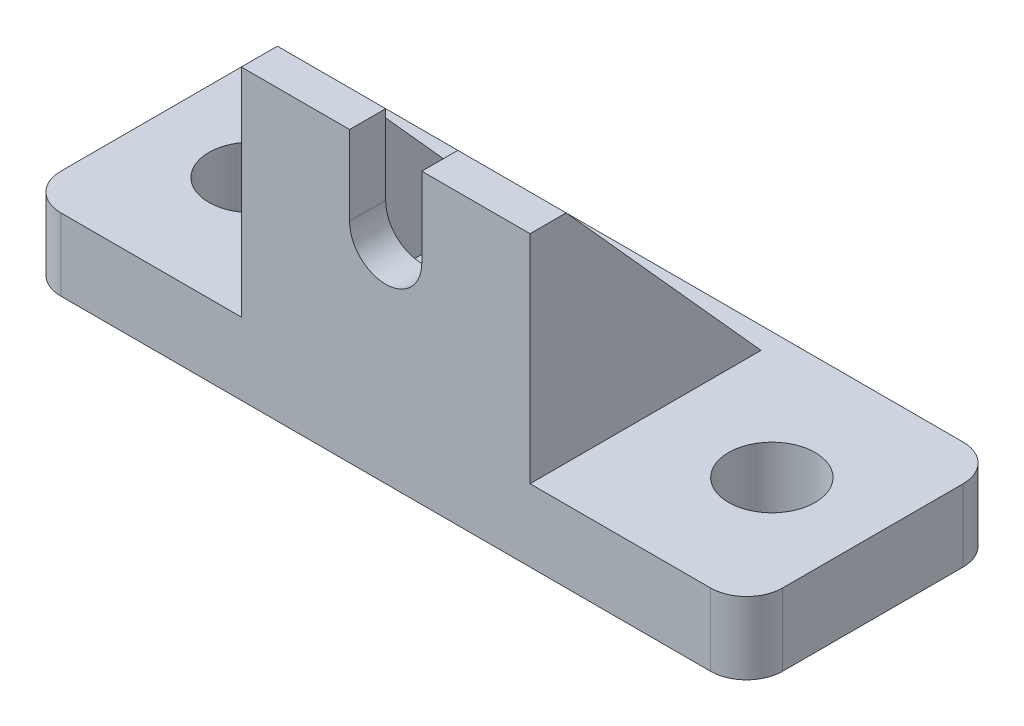
from build123d import *

# Parameters (mm, degrees)
IZIM1_R                     = 6
Y_KSEKLIK_EKSTR_ZYON1_DEPTH = 10
Y_KSEKLIK_EKSTR_ZYON2_DEPTH = 5
FEDER1_REACH                = 103.716
IZIM5_WALL_W                = 245.79202862
IZIM5_WALL_H                = 5
FEDER8_REACH                = 103.716
IZIM6_WALL_W                = 245.79202862
IZIM6_WALL_H                = 5


with BuildPart() as part:
    # Çizim1 → Yükseklik-Ekstrüzyon1 (new body)
    with BuildSketch(Plane(origin=(0, 0, 0), x_dir=(1, 0, 0), z_dir=(0, 1, 0))):
        with BuildLine():
            Line((-142.676154711, -27.016601459), (-52.676154711, -27.016601459))
            ThreePointArc((-52.676154711, -27.016601459), (-49.140620805, -28.481067553), (-47.676154711, -32.016601459))
            Line((-47.676154711, -32.016601459), (-47.676154711, -57.016601459))
            ThreePointArc((-47.676154711, -57.016601459), (-49.140620805, -60.552135365), (-52.676154711, -62.016601459))
            Line((-52.676154711, -62.016601459), (-142.676154711, -62.016601459))
            ThreePointArc((-142.676154711, -62.016601459), (-146.211688617, -60.552135365), (-147.676154711, -57.016601459))
            Line((-147.676154711, -57.016601459), (-147.676154711, -32.016601459))
            ThreePointArc((-147.676154711, -32.016601459), (-146.211688617, -28.481067553), (-142.676154711, -27.016601459))
        make_face()
        with Locations(Location((-133.676154711, -44.516601459, 0), (0, 0, 270))):
            Circle(IZIM1_R, mode=Mode.SUBTRACT)
        with Locations(Location((-61.676154711, -44.516601459, 0), (0, 0, 270))):
            Circle(IZIM1_R, mode=Mode.SUBTRACT)
    extrude(amount=Y_KSEKLIK_EKSTR_ZYON1_DEPTH)

    # Çizim3 → Yükseklik-Ekstrüzyon2 (add)
    with BuildSketch(Plane.XY.offset(62.016601459)):
        with BuildLine():
            Line((-117.676154711, 40), (-117.676154711, 10))
            Line((-117.676154711, 10), (-77.676154711, 10))
            Line((-77.676154711, 10), (-77.676154711, 40))
            Line((-77.676154711, 40), (-92.676154711, 40))
            Line((-92.676154711, 40), (-92.676154711, 29))
            ThreePointArc((-92.676154711, 29), (-97.676154711, 23.936325368), (-102.676154711, 29))
            Line((-102.676154711, 29), (-102.676154711, 40))
            Line((-102.676154711, 40), (-117.676154711, 40))
        make_face()
    extrude(amount=-Y_KSEKLIK_EKSTR_ZYON2_DEPTH)

    # Çizim5 wall → Feder1 (add, up to next)
    with BuildSketch(Plane(origin=(-77.676154711, 25, 43.516601459), x_dir=(0, -0.743294146247, -0.668964731622), z_dir=(0, 0.668964731622, -0.743294146247)), mode=Mode.PRIVATE) as feder1_sk1:
        with Locations((0, 2.5)):
            Rectangle(IZIM5_WALL_W, IZIM5_WALL_H)
    feder1_tool1 = extrude(feder1_sk1.sketch, amount=-FEDER1_REACH, mode=Mode.PRIVATE) - part.part
    add(feder1_tool1.solids().sort_by_distance((-77.676154711, 25, 43.516601459))[0])

    # Çizim6 wall → Feder8 (add, up to next)
    with BuildSketch(Plane(origin=(-117.676154711, 25, 43.516601459), x_dir=(0, -0.743294146247, -0.668964731622), z_dir=(0, -0.668964731622, 0.743294146247)), mode=Mode.PRIVATE) as feder8_sk1:
        with Locations((0, 2.5)):
            Rectangle(IZIM6_WALL_W, IZIM6_WALL_H)
    feder8_tool1 = extrude(feder8_sk1.sketch, amount=FEDER8_REACH, mode=Mode.PRIVATE) - part.part
    add(feder8_tool1.solids().sort_by_distance((-117.676154711, 25, 43.516601459))[0])


solid = part.part
